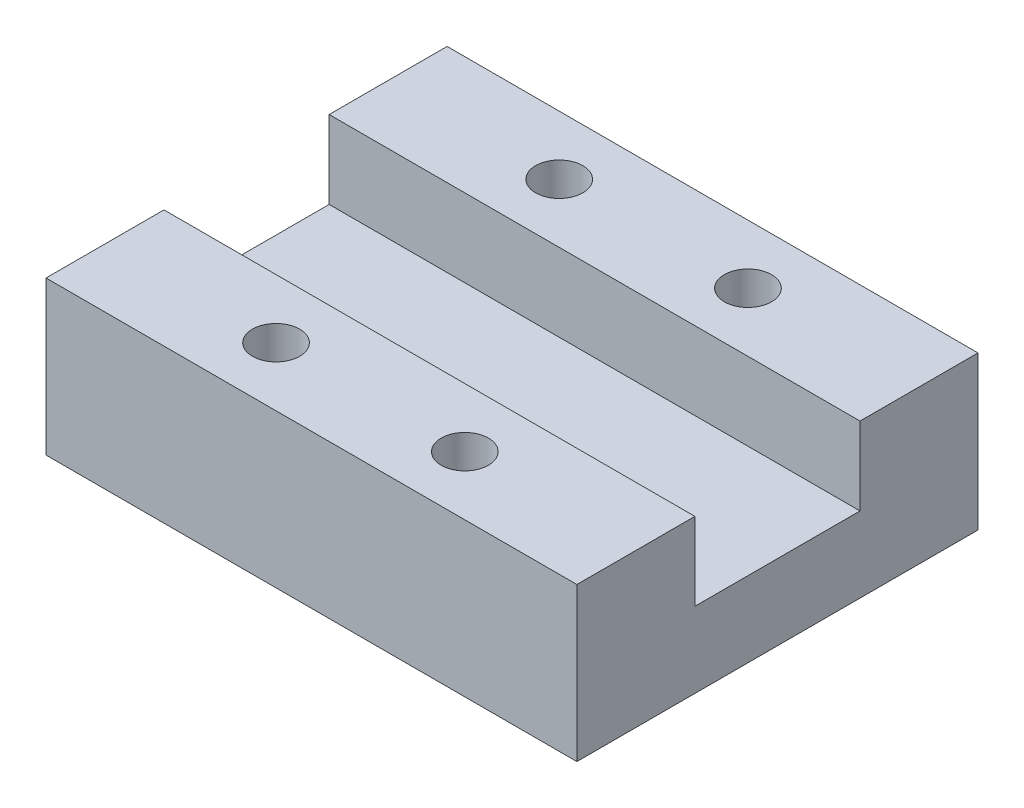
from build123d import *

# Parameters (mm, degrees)
SKETCH_1_W      = 22.5
SKETCH_1_H      = 17
SKETCH_1_R      = 1
EXTRUDE_1_DEPTH = 3.2
SKETCH_2_W      = 22.5
SKETCH_2_H      = 5
SKETCH_2_R      = 1
EXTRUDE_2_DEPTH = 3.3


with BuildPart() as part:
    # 草图1 → 凸台-拉伸1 (new body)
    with BuildSketch(Plane(origin=(0, 0, 0), x_dir=(1, 0, 0), z_dir=(0, 1, 0))):
        Rectangle(SKETCH_1_W, SKETCH_1_H)
        with Locations(Location((4, 6, 0), (0, 0, 270))):
            Circle(SKETCH_1_R, mode=Mode.SUBTRACT)
        with Locations(Location((-4, 6, 0), (0, 0, 270))):
            Circle(SKETCH_1_R, mode=Mode.SUBTRACT)
        with Locations(Location((-4, -6, 0), (0, 0, 270))):
            Circle(SKETCH_1_R, mode=Mode.SUBTRACT)
        with Locations(Location((4, -6, 0), (0, 0, 270))):
            Circle(SKETCH_1_R, mode=Mode.SUBTRACT)
    extrude(amount=EXTRUDE_1_DEPTH)

    # 草图2 → 凸台-拉伸2 (add)
    # profile 1 of 2: a face of its own
    with BuildSketch(Plane(origin=(0, 3.2, 0), x_dir=(1, 0, 0), z_dir=(0, 1, 0))):
        with Locations((0, 6)):
            Rectangle(SKETCH_2_W, SKETCH_2_H)
        with Locations(Location((-4, 6, 0), (0, 0, 270))):
            Circle(SKETCH_2_R, mode=Mode.SUBTRACT)
        with Locations(Location((4, 6, 0), (0, 0, 270))):
            Circle(SKETCH_2_R, mode=Mode.SUBTRACT)
    # profile 2 of 2: a face of its own
    with BuildSketch(Plane(origin=(0, 3.2, 0), x_dir=(1, 0, 0), z_dir=(0, 1, 0))):
        with Locations((0, -6)):
            Rectangle(SKETCH_2_W, SKETCH_2_H)
        with Locations(Location((-4, -6, 0), (0, 0, 270))):
            Circle(SKETCH_2_R, mode=Mode.SUBTRACT)
        with Locations(Location((4, -6, 0), (0, 0, 270))):
            Circle(SKETCH_2_R, mode=Mode.SUBTRACT)
    extrude(amount=EXTRUDE_2_DEPTH)


solid = part.part
